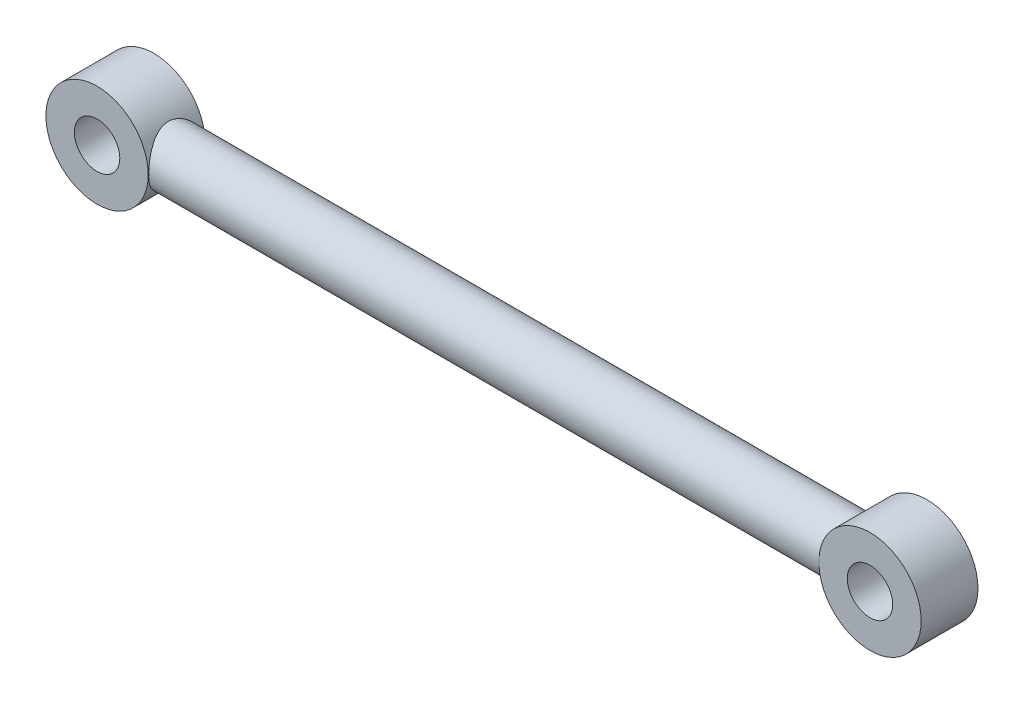
from build123d import *

# Parameters (mm, degrees)
SKETCH_1_R        = 4.5
SKETCH_1_R_2      = 2
EXTRUDE_1_DEPTH   = 2.5
EXTRUDE_1_2_DEPTH = 2.5
SKETCH_2_R        = 2.45
EXTRUDE_2_DEPTH   = 31


with BuildPart() as part:
    # 草图1 → 凸台-拉伸1 (new, symmetric)
    with BuildSketch(Plane.XY):
        with Locations((34, 0)):
            Circle(SKETCH_1_R)
        with Locations((34, 0)):
            Circle(SKETCH_1_R_2, mode=Mode.SUBTRACT)
    extrude(amount=EXTRUDE_1_DEPTH, both=True)


with BuildPart() as body_2:
    # 草图1 → Extrude 1 2 (new, symmetric)
    with BuildSketch(Plane.XY):
        with Locations((-34, 0)):
            Circle(SKETCH_1_R)
        with Locations((-34, 0)):
            Circle(SKETCH_1_R_2, mode=Mode.SUBTRACT)
    extrude(amount=EXTRUDE_1_2_DEPTH, both=True)


with BuildPart() as body_3:
    # 草图2 → 凸台-拉伸2 (new, symmetric)
    with BuildSketch(Plane(origin=(0, 0, 0), x_dir=(0, 0, -1), z_dir=(1, 0, 0))):
        Circle(SKETCH_2_R)
    extrude(amount=EXTRUDE_2_DEPTH, both=True)


solid = Compound([part.part, body_2.part, body_3.part])
